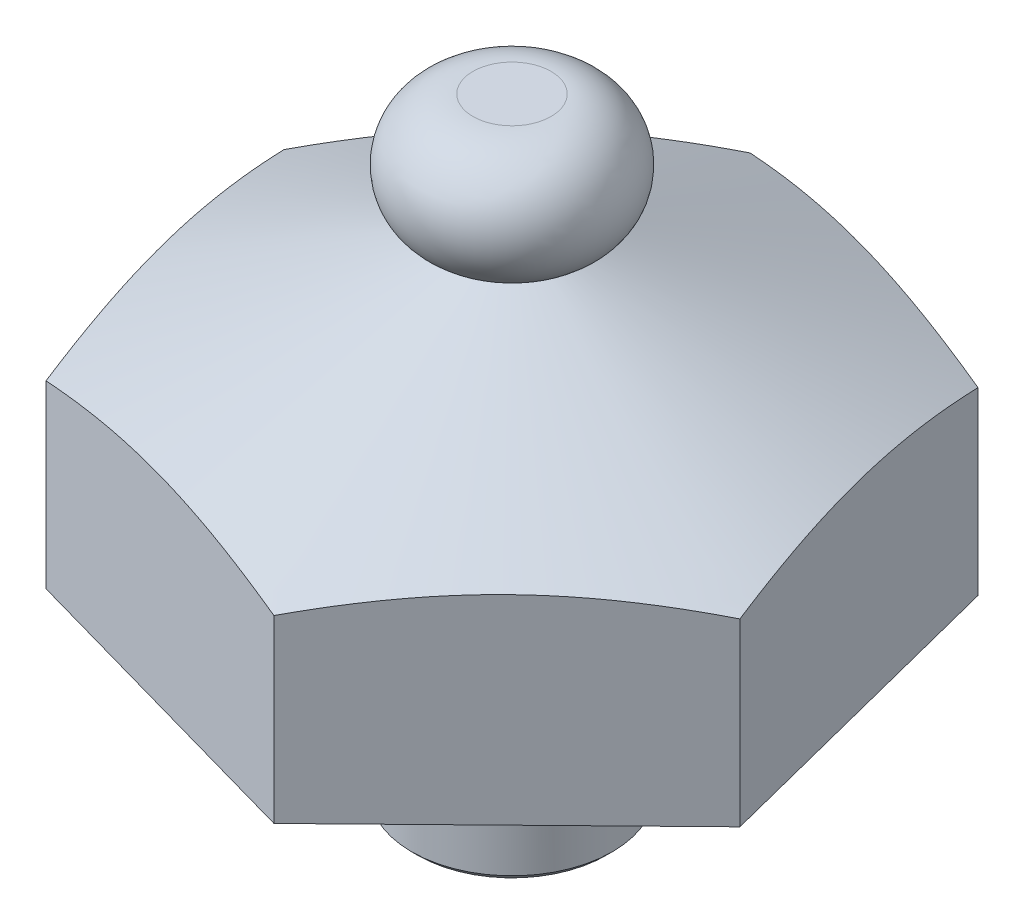
from build123d import *

# Parameters (mm, degrees)
SKETCH2_OUTSIDE_W  = 146.052
SKETCH2_OUTSIDE_H  = 146.052
CUT_EXTRUDE1_DEPTH = 126.665925527
CHAMFER1_SIZE      = 1


with BuildPart() as part:
    # Sketch1 → Revolve1 (revolve)
    with BuildSketch(Plane.XY, mode=Mode.PRIVATE) as revolve1_sk:
        with BuildLine():
            Line((0, 100), (-6.380027739, 100))
            ThreePointArc((-6.380027739, 100), (-16.380027739, 90), (-6.380027739, 80))
            Line((-6.380027739, 80), (-53.814147018, 58.94590846))
            Line((-53.814147018, 58.94590846), (-53.814147018, 29.542302358))
            Line((-53.814147018, 29.542302358), (-16.380027739, 29.542302358))
            Line((-16.380027739, 29.542302358), (-16.380027739, 0))
            Line((-16.380027739, 0), (0, 0))
            Line((0, 0), (0, 100))
        make_face()
    revolve(revolve1_sk.sketch.rotate(Axis((0, 0, 0), (0, 1, 0)), 270), axis=Axis((0, 0, 0), (0, 1, 0)))

    # Sketch2 outside → Cut-Extrude1 (cut, through all)
    with BuildSketch(Plane(origin=(0, 100, 0), x_dir=(1, 0, 0), z_dir=(0, 1, 0))):
        Rectangle(SKETCH2_OUTSIDE_W, SKETCH2_OUTSIDE_H)
        Polygon((-38.527261507, -37.5714325), (13.274184248, -52.151303453), (51.801445755, -14.579870953), (38.527261507, 37.5714325), (-13.274184248, 52.151303453), (-51.801445755, 14.579870953), align=None, mode=Mode.SUBTRACT)
    extrude(amount=-CUT_EXTRUDE1_DEPTH, mode=Mode.SUBTRACT)

    # Chamfer1
    chamfer1_edges = [part.edges().sort_by_distance(p)[0] for p in [
        (0, 0, 16.380027739),
    ]]
    chamfer(chamfer1_edges, length=CHAMFER1_SIZE)


solid = part.part
